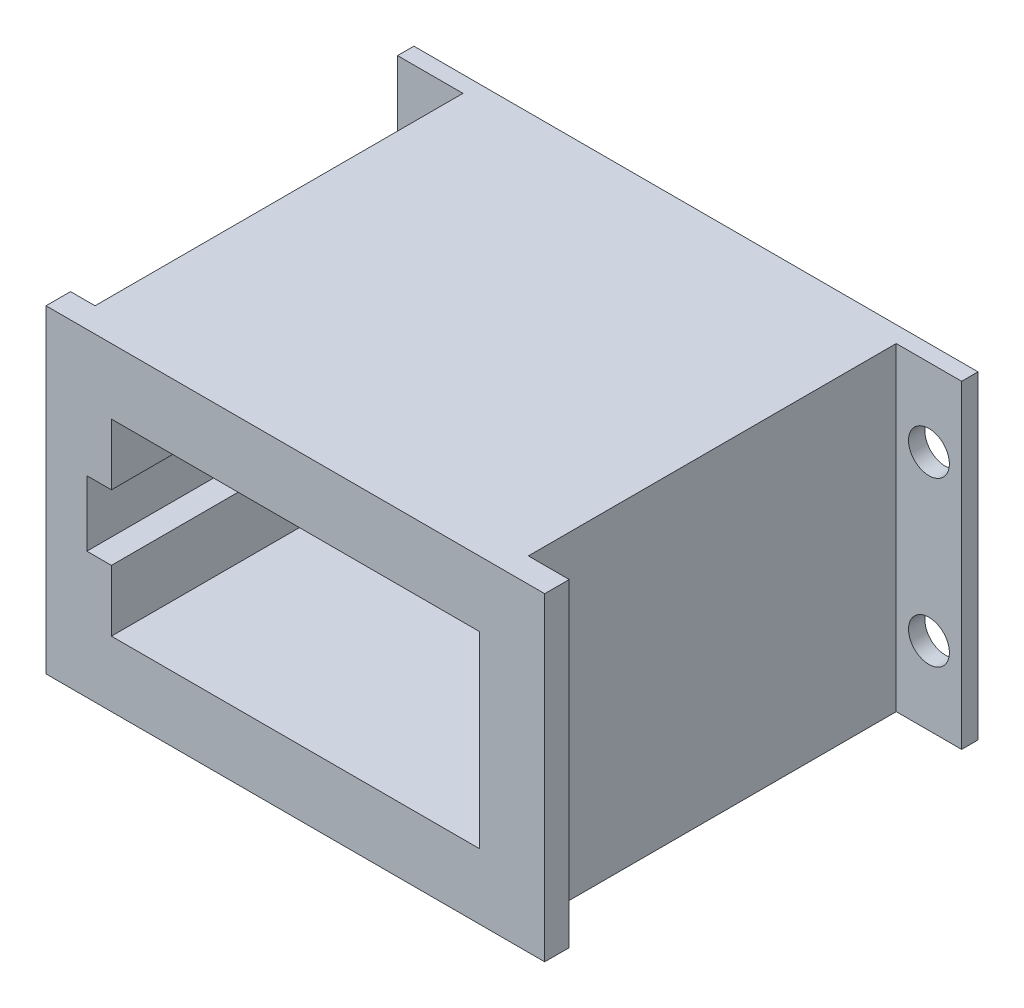
from build123d import *

# Parameters (mm, degrees)
BOSS_EXTRUDE1_DEPTH = 50
SKETCH2_W           = 3
SKETCH2_H           = 45
CUT_EXTRUDE1_DEPTH  = 50
SKETCH3_W           = 2
SKETCH3_H           = 45
CUT_EXTRUDE2_DEPTH  = 83.643814046
SKETCH4_W           = 3
SKETCH4_H           = 2
BOSS_EXTRUDE2_DEPTH = 39
SKETCH5_W           = 8
SKETCH5_H           = 2
BOSS_EXTRUDE3_DEPTH = 39
CUT_EXTRUDE3_REACH  = 83.222
SKETCH6_R           = 2.5


with BuildPart() as part:
    # Sketch1 → Boss-Extrude1 (new body)
    with BuildSketch(Plane.XY):
        Polygon((-8, 8), (53, 8), (53, -31), (-8, -31), (-8, -23.5), (-8, 0.5), align=None)
        Polygon((0, 0), (45, 0), (45, -23), (0, -23), (0, -15.5), (-3, -15.5), (-3, -7.5), (0, -7.5), align=None, mode=Mode.SUBTRACT)
    extrude(amount=BOSS_EXTRUDE1_DEPTH)

    # Sketch2 → Cut-Extrude1 (cut)
    with BuildSketch(Plane(origin=(0, 8, 0), x_dir=(1, 0, 0), z_dir=(0, 1, 0))):
        with Locations((-6.5, -24.5)):
            Rectangle(SKETCH2_W, SKETCH2_H)
        with Locations((51.5, -24.5)):
            Rectangle(SKETCH2_W, SKETCH2_H)
    extrude(amount=-CUT_EXTRUDE1_DEPTH, mode=Mode.SUBTRACT)

    # Sketch3 → Cut-Extrude2 (cut, through all)
    with BuildSketch(Plane(origin=(0, 8, 0), x_dir=(1, 0, 0), z_dir=(0, 1, 0))):
        with Locations((49, -24.5)):
            Rectangle(SKETCH3_W, SKETCH3_H)
    extrude(amount=-CUT_EXTRUDE2_DEPTH, mode=Mode.SUBTRACT)

    # Sketch4 → Boss-Extrude2 (add)
    with BuildSketch(Plane(origin=(0, 8, 0), x_dir=(1, 0, 0), z_dir=(0, 1, 0))):
        with Locations((54.5, -1)):
            Rectangle(SKETCH4_W, SKETCH4_H)
    extrude(amount=-BOSS_EXTRUDE2_DEPTH)

    # Sketch5 → Boss-Extrude3 (add)
    with BuildSketch(Plane(origin=(0, 8, 0), x_dir=(1, 0, 0), z_dir=(0, 1, 0))):
        with Locations((-9, -1)):
            Rectangle(SKETCH5_W, SKETCH5_H)
    extrude(amount=-BOSS_EXTRUDE3_DEPTH)

    # Sketch6 → Cut-Extrude3 (cut, up to next)
    with BuildSketch(Plane(origin=(0, 0, 0), x_dir=(-1, 0, 0), z_dir=(0, 0, -1)), mode=Mode.PRIVATE) as cut_extrude3_sk1:
        with Locations((-52, -1.5)):
            Circle(SKETCH6_R)
    cut_extrude3_tool1 = extrude(cut_extrude3_sk1.sketch, amount=-CUT_EXTRUDE3_REACH, mode=Mode.PRIVATE) & part.part
    # Sketch6 → Cut-Extrude3 (cut, up to next)
    with BuildSketch(Plane(origin=(0, 0, 0), x_dir=(-1, 0, 0), z_dir=(0, 0, -1)), mode=Mode.PRIVATE) as cut_extrude3_sk2:
        with Locations((-52, -21.5)):
            Circle(SKETCH6_R)
    cut_extrude3_tool2 = extrude(cut_extrude3_sk2.sketch, amount=-CUT_EXTRUDE3_REACH, mode=Mode.PRIVATE) & part.part
    # Sketch6 → Cut-Extrude3 (cut, up to next)
    with BuildSketch(Plane(origin=(0, 0, 0), x_dir=(-1, 0, 0), z_dir=(0, 0, -1)), mode=Mode.PRIVATE) as cut_extrude3_sk3:
        with Locations((9, -21.5)):
            Circle(SKETCH6_R)
    cut_extrude3_tool3 = extrude(cut_extrude3_sk3.sketch, amount=-CUT_EXTRUDE3_REACH, mode=Mode.PRIVATE) & part.part
    # Sketch6 → Cut-Extrude3 (cut, up to next)
    with BuildSketch(Plane(origin=(0, 0, 0), x_dir=(-1, 0, 0), z_dir=(0, 0, -1)), mode=Mode.PRIVATE) as cut_extrude3_sk4:
        with Locations((9, -1.5)):
            Circle(SKETCH6_R)
    cut_extrude3_tool4 = extrude(cut_extrude3_sk4.sketch, amount=-CUT_EXTRUDE3_REACH, mode=Mode.PRIVATE) & part.part
    add(cut_extrude3_tool1.solids().sort_by_distance((52, -1.5, 0))[0], mode=Mode.SUBTRACT)
    add(cut_extrude3_tool2.solids().sort_by_distance((52, -21.5, 0))[0], mode=Mode.SUBTRACT)
    add(cut_extrude3_tool3.solids().sort_by_distance((-9, -21.5, 0))[0], mode=Mode.SUBTRACT)
    add(cut_extrude3_tool4.solids().sort_by_distance((-9, -1.5, 0))[0], mode=Mode.SUBTRACT)


solid = part.part
